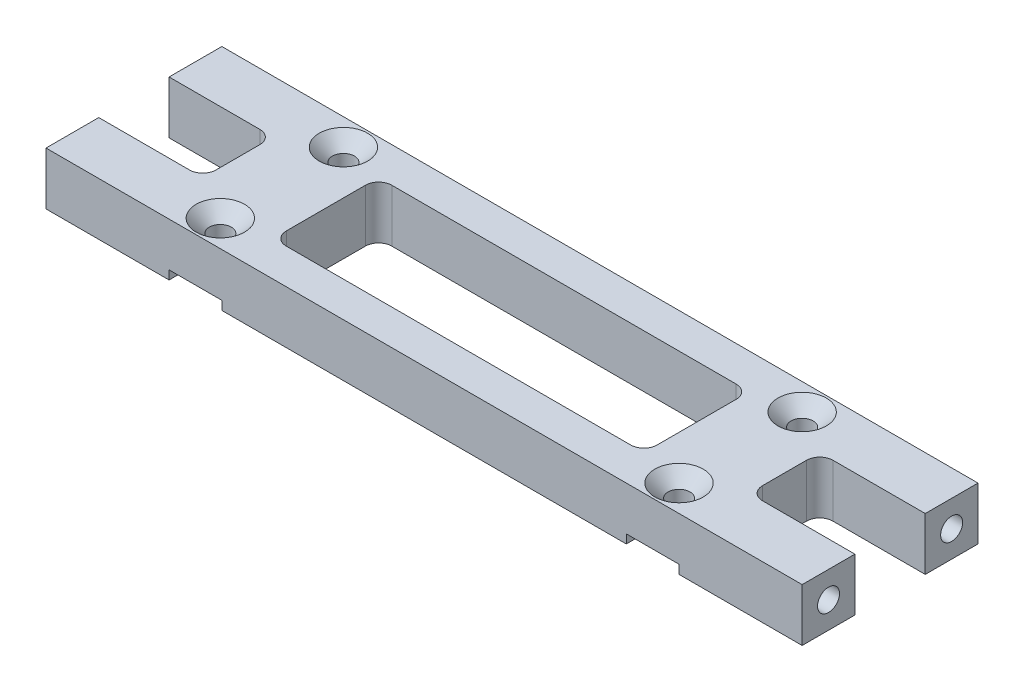
from build123d import *

# Parameters (mm, degrees)
SKETCH2_W                   = 86
SKETCH2_H                   = 20
BOSS_EXTRUDE1_DEPTH         = 6
TAP_DRILL_FOR_M3_TAP2_D     = 2.5
TAP_DRILL_FOR_M3_TAP2_DEPTH = 8
TAP_DRILL_FOR_M3_TAP2_TIP   = 0.751075774
TAP_DRILL_FOR_M3_TAP1_D     = 2.5
TAP_DRILL_FOR_M3_TAP1_DEPTH = 8
TAP_DRILL_FOR_M3_TAP1_TIP   = 0.751075774
SKETCH7_W                   = 6
SKETCH7_H                   = 20
CUT_EXTRUDE1_DEPTH          = 1
TAP_DRILL_FOR_M3X0_5_TAP1_D = 2.5
CHAMFER1_SIZE               = 1.5
CUT_EXTRUDE2_REACH          = 90.499
SKETCH9_W                   = 42.171572875
SKETCH9_H                   = 12
SKETCH9_W_2                 = 11.828427125
SKETCH9_H_2                 = 8
SKETCH9_W_3                 = 12
FILLET1_R                   = 1.5


with BuildPart() as part:
    # Sketch2 → Boss-Extrude1 (new body)
    with BuildSketch(Plane(origin=(0, 0, 0), x_dir=(1, 0, 0), z_dir=(0, 1, 0))):
        with Locations((43, -10)):
            Rectangle(SKETCH2_W, SKETCH2_H)
    extrude(amount=BOSS_EXTRUDE1_DEPTH)

    # Tap Drill for M3 Tap2
    with Locations(Plane(origin=(86, 0.779165189, 7.640466368), x_dir=(0, 0, -1), z_dir=(1, 0, 0))):
        with Locations((-9.359533632, 2.220834811), (4.640466368, 2.220834811)):
            Hole(TAP_DRILL_FOR_M3_TAP2_D / 2, depth=TAP_DRILL_FOR_M3_TAP2_DEPTH)
            with Locations((0, 0, -(TAP_DRILL_FOR_M3_TAP2_DEPTH + TAP_DRILL_FOR_M3_TAP2_TIP / 2))):  # 118° drill point
                Cone(0, TAP_DRILL_FOR_M3_TAP2_D / 2, TAP_DRILL_FOR_M3_TAP2_TIP, mode=Mode.SUBTRACT)

    # Tap Drill for M3 Tap1
    with Locations(Plane.ZY):
        with Locations((3, 3), (17, 3)):
            Hole(TAP_DRILL_FOR_M3_TAP1_D / 2, depth=TAP_DRILL_FOR_M3_TAP1_DEPTH)
            with Locations((0, 0, -(TAP_DRILL_FOR_M3_TAP1_DEPTH + TAP_DRILL_FOR_M3_TAP1_TIP / 2))):  # 118° drill point
                Cone(0, TAP_DRILL_FOR_M3_TAP1_D / 2, TAP_DRILL_FOR_M3_TAP1_TIP, mode=Mode.SUBTRACT)

    # Sketch7 → Cut-Extrude1 (cut)
    with BuildSketch(Plane.XZ):
        with Locations((17, 10)):
            Rectangle(SKETCH7_W, SKETCH7_H)
        with Locations((69, 10)):
            Rectangle(SKETCH7_W, SKETCH7_H)
    extrude(amount=-CUT_EXTRUDE1_DEPTH, mode=Mode.SUBTRACT)

    # Tap Drill for M3x0.5 Tap1 (through all)
    with Locations(Plane(origin=(16.828427125, 1, 17), x_dir=(0, 0, -1), z_dir=(0, -1, 0))):
        with Locations((0, 0), (14, 0), (0, 52.171572875), (14, 52.171572875)):
            Hole(TAP_DRILL_FOR_M3X0_5_TAP1_D / 2)

    # Chamfer1
    chamfer1_edges = [part.edges().sort_by_distance(p)[0] for p in [
        (69, 6, 1.75),
        (69, 6, 15.75),
        (16.828427125, 6, 1.75),
        (16.828427125, 6, 15.75),
    ]]
    chamfer(chamfer1_edges, length=CHAMFER1_SIZE)

    # Sketch9 → Cut-Extrude2 (cut, up to next)
    with BuildSketch(Plane(origin=(0, 6, 0), x_dir=(1, 0, 0), z_dir=(0, 1, 0)), mode=Mode.PRIVATE) as cut_extrude2_sk1:
        with Locations((42.914213563, -10)):
            Rectangle(SKETCH9_W, SKETCH9_H)
    cut_extrude2_tool1 = extrude(cut_extrude2_sk1.sketch, amount=-CUT_EXTRUDE2_REACH, mode=Mode.PRIVATE) & part.part
    # Sketch9 → Cut-Extrude2 (cut, up to next)
    with BuildSketch(Plane(origin=(0, 6, 0), x_dir=(1, 0, 0), z_dir=(0, 1, 0)), mode=Mode.PRIVATE) as cut_extrude2_sk2:
        with Locations((5.914213563, -10)):
            Rectangle(SKETCH9_W_2, SKETCH9_H_2)
    cut_extrude2_tool2 = extrude(cut_extrude2_sk2.sketch, amount=-CUT_EXTRUDE2_REACH, mode=Mode.PRIVATE) & part.part
    # Sketch9 → Cut-Extrude2 (cut, up to next)
    with BuildSketch(Plane(origin=(0, 6, 0), x_dir=(1, 0, 0), z_dir=(0, 1, 0)), mode=Mode.PRIVATE) as cut_extrude2_sk3:
        with Locations((80, -10)):
            Rectangle(SKETCH9_W_3, SKETCH9_H_2)
    cut_extrude2_tool3 = extrude(cut_extrude2_sk3.sketch, amount=-CUT_EXTRUDE2_REACH, mode=Mode.PRIVATE) & part.part
    add(cut_extrude2_tool1.solids().sort_by_distance((42.914214, 6, 10))[0], mode=Mode.SUBTRACT)
    add(cut_extrude2_tool2.solids().sort_by_distance((5.914214, 6, 10))[0], mode=Mode.SUBTRACT)
    add(cut_extrude2_tool3.solids().sort_by_distance((80, 6, 10))[0], mode=Mode.SUBTRACT)

    # Fillet1
    fillet1_edges = [part.edges().sort_by_distance(p)[0] for p in [
        (21.828427125, 3, 16),
        (21.828427125, 3, 4),
        (64, 3, 4),
        (64, 3, 16),
        (11.828427125, 3, 6),
        (11.828427125, 3, 14),
        (74, 3, 14),
        (74, 3, 6),
    ]]
    fillet(fillet1_edges, radius=FILLET1_R)


solid = part.part
